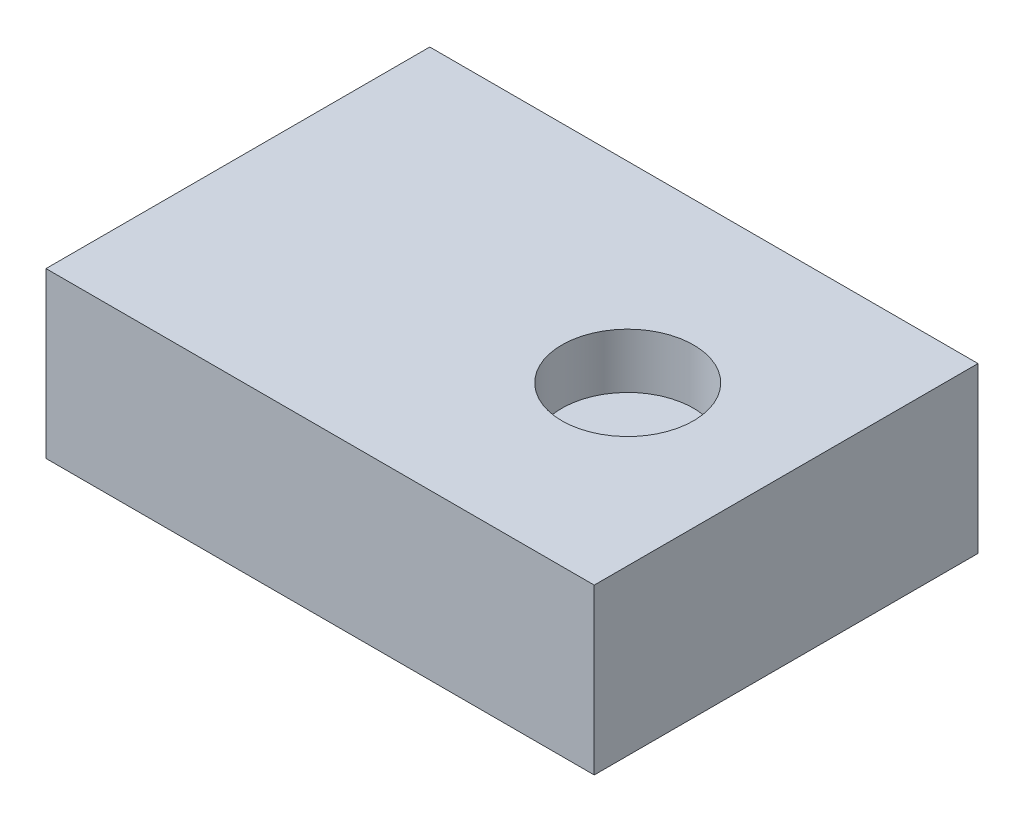
from build123d import *

# Parameters (mm, degrees)
SKETCH_1_W          = 100
SKETCH_1_H          = 70
EXTRUDE_1_DEPTH     = 30
SKETCH_2_R          = 12
CUT_EXTRUDE_1_DEPTH = 10


with BuildPart() as part:
    # Эскиз1 → Бобышка-Вытянуть1 (new body)
    with BuildSketch(Plane(origin=(0, 0, 0), x_dir=(1, 0, 0), z_dir=(0, 1, 0))):
        with Locations((-13.067931475, 16.72924732)):
            Rectangle(SKETCH_1_W, SKETCH_1_H)
    extrude(amount=EXTRUDE_1_DEPTH)

    # Эскиз2 → Вырез-Вытянуть1 (cut)
    with BuildSketch(Plane(origin=(0, 30, 0), x_dir=(1, 0, 0), z_dir=(0, 1, 0))):
        with Locations(Location((8.03919791, 16.72924732, 0), (0, 0, 270))):
            Circle(SKETCH_2_R)
    extrude(amount=-CUT_EXTRUDE_1_DEPTH, mode=Mode.SUBTRACT)


solid = part.part
